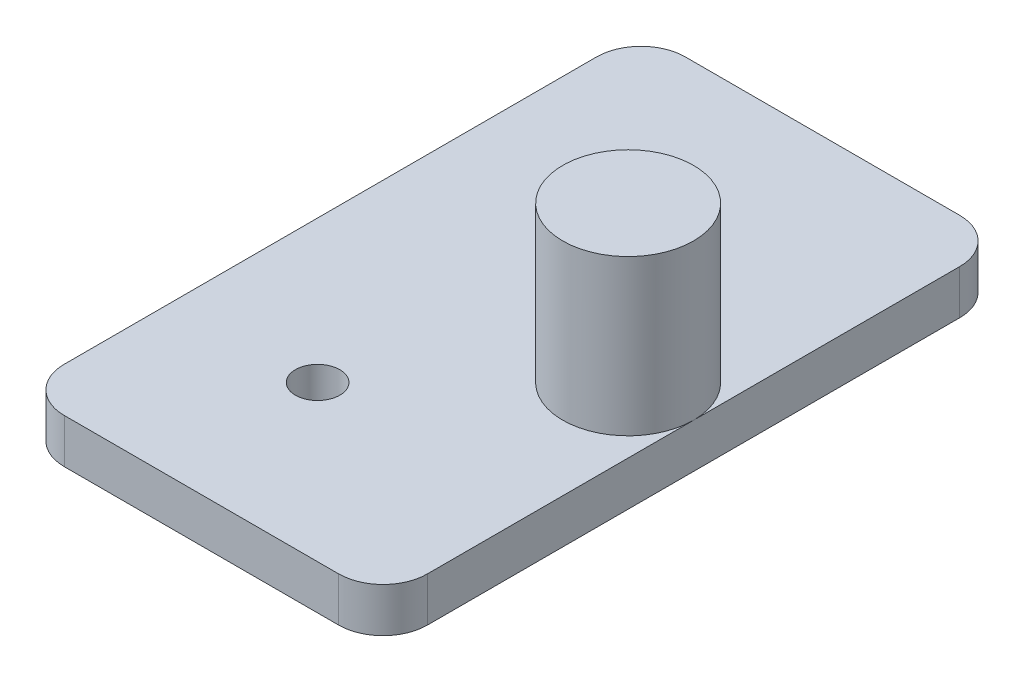
from build123d import *

# Parameters (mm, degrees)
SKETCH_1_R      = 2.95
EXTRUDE_1_DEPTH = 9
SKETCH_2_R      = 1
EXTRUDE_2_DEPTH = 2
FILLET_1_R      = 2


with BuildPart() as part:
    # 草图1 → 凸台-拉伸1 (new body)
    with BuildSketch(Plane(origin=(0, 0, 0), x_dir=(1, 0, 0), z_dir=(0, 1, 0))):
        with Locations(Location((17.5, 0, 0), (0, 0, 270))):
            Circle(SKETCH_1_R)
    extrude(amount=EXTRUDE_1_DEPTH)

    # 草图2 → 凸台-拉伸2 (add)
    with BuildSketch(Plane(origin=(0, 0, 0), x_dir=(1, 0, 0), z_dir=(0, 1, 0))):
        Polygon((4.078263357, 14), (4.078263357, -14), (20, -14), (20.45, -14), (20.45, 14), (20, 14), align=None)
        with Locations(Location((10.5, -7, 0), (0, 0, 270))):
            Circle(SKETCH_2_R, mode=Mode.SUBTRACT)
        with Locations(Location((10.5, 7, 0), (0, 0, 270))):
            Circle(SKETCH_2_R, mode=Mode.SUBTRACT)
    extrude(amount=EXTRUDE_2_DEPTH)

    # 圆角1
    fillet_1_edges = [part.edges().sort_by_distance(p)[0] for p in [
        (4.078263357, 1, 14),
        (20.45, 1, 14),
        (20.45, 1, -14),
        (4.078263357, 1, -14),
    ]]
    fillet(fillet_1_edges, radius=FILLET_1_R)


solid = part.part
